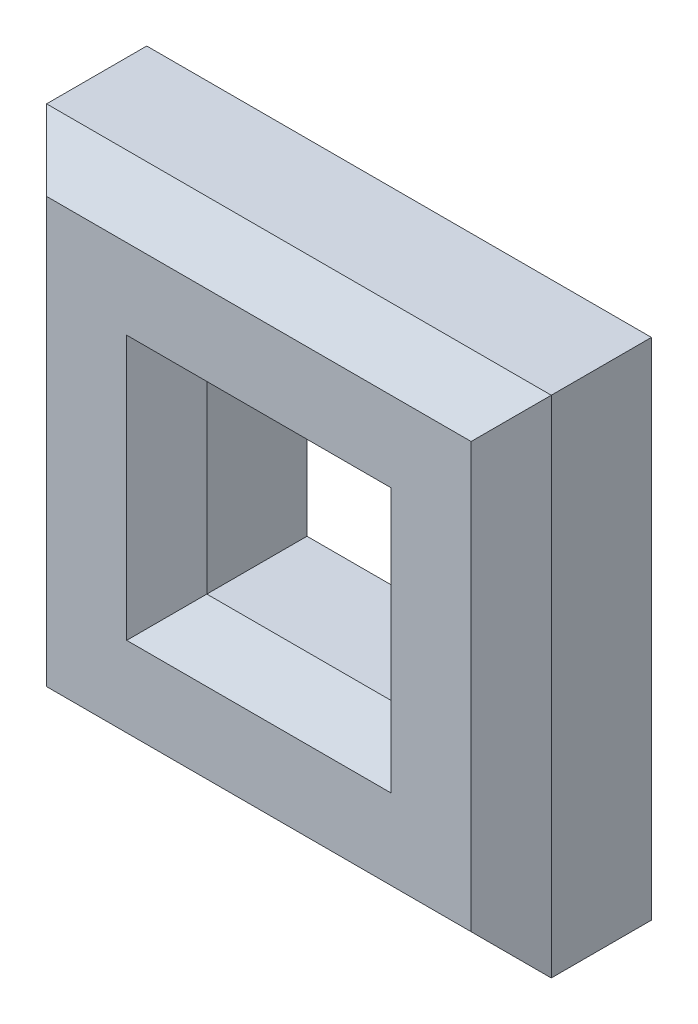
from build123d import *

# Parameters (mm, degrees)
SKETCH1_W           = 12.596194078
SKETCH1_H           = 12.596194078
SKETCH1_W_2         = 4.596194078
SKETCH1_H_2         = 4.596194078
BOSS_EXTRUDE1_DEPTH = 3.5
CHAMFER1_SIZE       = 1


with BuildPart() as part:
    # Sketch1 → Boss-Extrude1 (new body)
    with BuildSketch(Plane.XY):
        Rectangle(SKETCH1_W, SKETCH1_H)
        Rectangle(SKETCH1_W_2, SKETCH1_H_2, mode=Mode.SUBTRACT)
    extrude(amount=BOSS_EXTRUDE1_DEPTH)

    # Chamfer1
    chamfer1_edges = [part.edges().sort_by_distance(p)[0] for p in [
        (6.298097039, 0, 3.5),
        (-2.298097039, 0, 3.5),
        (0, 6.298097039, 3.5),
        (0, -2.298097039, 3.5),
        (2.298097039, 0, 3.5),
        (0, 2.298097039, 3.5),
        (-6.298097039, 0, 3.5),
        (0, -6.298097039, 3.5),
    ]]
    chamfer(chamfer1_edges, length=CHAMFER1_SIZE)


solid = part.part
